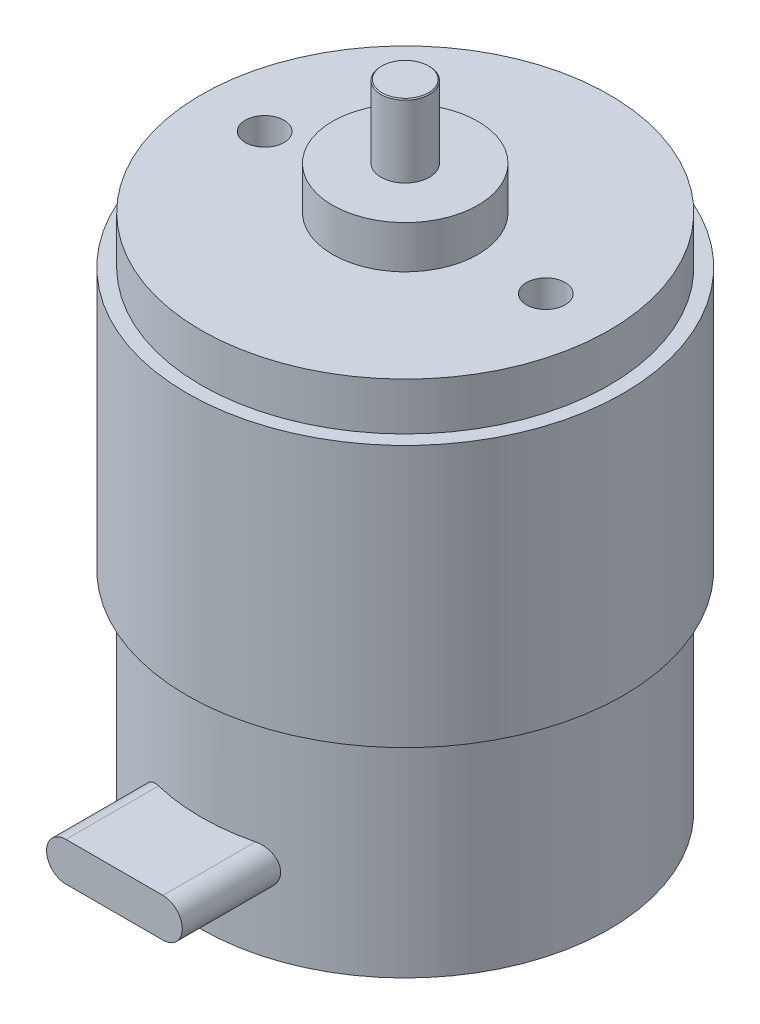
from build123d import *

# Parameters (mm, degrees)
SKETCH_1_R          = 7.5
EXTRUDE_1_DEPTH     = 4.3
SKETCH_2_R          = 21.05
EXTRUDE_2_DEPTH     = 53.5
SKETCH_3_R          = 7.5
EXTRUDE_3_DEPTH     = 4.4
SKETCH_5_R          = 22.5
EXTRUDE_5_DEPTH     = 27
SKETCH_6_R          = 2.5
EXTRUDE_6_DEPTH     = 70
SKETCH_7_R          = 2
CUT_EXTRUDE_1_DEPTH = 5
CHAMFER_1_SIZE      = 0.1
EXTRUDE_7_DEPTH     = 30


with BuildPart() as part:
    # ｽｹｯﾁ1 → ﾎﾞｽ - 押し出し1 (new body)
    with BuildSketch(Plane(origin=(0, 0, 0), x_dir=(1, 0, 0), z_dir=(0, 1, 0))):
        with Locations(Location((0, 0, 0), (0, 0, 90))):
            Circle(SKETCH_1_R)
    extrude(amount=EXTRUDE_1_DEPTH)

    # ｽｹｯﾁ2 → ﾎﾞｽ - 押し出し2 (add)
    with BuildSketch(Plane(origin=(0, 4.3, 0), x_dir=(1, 0, 0), z_dir=(0, 1, 0))):
        with Locations(Location((0, 0, 0), (0, 0, 270))):
            Circle(SKETCH_2_R)
    extrude(amount=EXTRUDE_2_DEPTH)

    # ｽｹｯﾁ3 → ﾎﾞｽ - 押し出し3 (add)
    with BuildSketch(Plane(origin=(0, 57.8, 0), x_dir=(1, 0, 0), z_dir=(0, 1, 0))):
        with Locations(Location((0, 0, 0), (0, 0, 90))):
            Circle(SKETCH_3_R)
    extrude(amount=EXTRUDE_3_DEPTH)

    # ｽｹｯﾁ5 → ﾎﾞｽ - 押し出し5 (add)
    with BuildSketch(Plane(origin=(0, 52.9, 0), x_dir=(1, 0, 0), z_dir=(0, 1, 0))):
        with Locations(Location((0, 0, 0), (0, 0, 270))):
            Circle(SKETCH_5_R)
    extrude(amount=-EXTRUDE_5_DEPTH)

    # ｽｹｯﾁ6 → ﾎﾞｽ - 押し出し6 (add)
    with BuildSketch(Plane(origin=(0, 69.7, 0), x_dir=(1, 0, 0), z_dir=(0, 1, 0))):
        with Locations(Location((0, 0, 0), (0, 0, 270))):
            Circle(SKETCH_6_R)
    extrude(amount=-EXTRUDE_6_DEPTH)

    # ｽｹｯﾁ7 → ｶｯﾄ - 押し出し1 (cut)
    with BuildSketch(Plane(origin=(0, 57.8, 0), x_dir=(1, 0, 0), z_dir=(0, 1, 0))):
        with Locations(Location((14.5, 0, 0), (0, 0, 270))):
            Circle(SKETCH_7_R)
        with Locations(Location((-14.5, 0, 0), (0, 0, 270))):
            Circle(SKETCH_7_R)
    extrude(amount=-CUT_EXTRUDE_1_DEPTH, mode=Mode.SUBTRACT)

    # 面取り1
    chamfer_1_edges = [part.edges().sort_by_distance(p)[0] for p in [
        (0, -0.3, -2.5),
        (0, 69.7, -2.5),
    ]]
    chamfer(chamfer_1_edges, length=CHAMFER_1_SIZE)

    # ｽｹｯﾁ8 → ﾎﾞｽ - 押し出し7 (add)
    with BuildSketch(Plane.XY):
        with BuildLine():
            Line((-5, 14.3), (5, 14.3))
            ThreePointArc((5, 14.3), (7, 12.3), (5, 10.3))
            Line((5, 10.3), (-5, 10.3))
            ThreePointArc((-5, 10.3), (-7, 12.3), (-5, 14.3))
        make_face()
    extrude(amount=EXTRUDE_7_DEPTH)


solid = part.part
